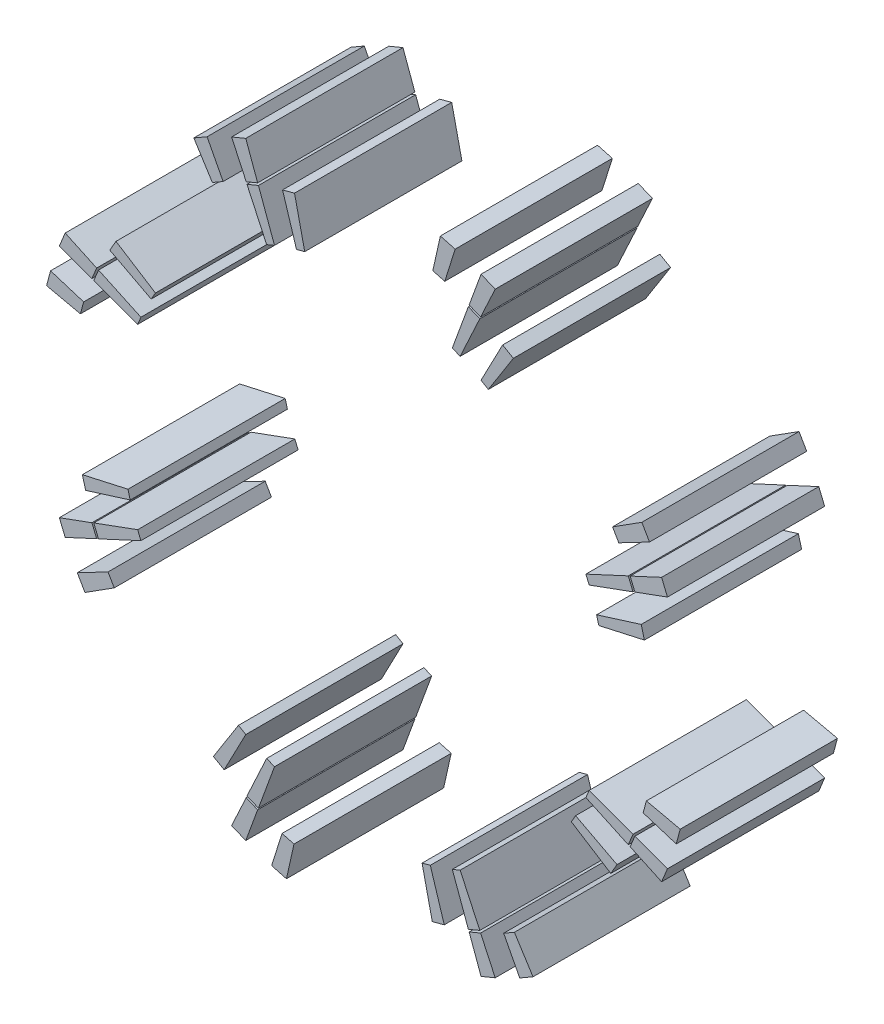
from build123d import *

# Parameters (mm, degrees)
SLOT_COPPER_ENVELOPES_START    = -15
SLOT_COPPER_ENVELOPES_DEPTH    = 30
SLOT_COPPER_ENVELOPES_2_DEPTH  = 30
SLOT_COPPER_ENVELOPES_3_DEPTH  = 30
SLOT_COPPER_ENVELOPES_4_DEPTH  = 30
SLOT_COPPER_ENVELOPES_5_DEPTH  = 30
SLOT_COPPER_ENVELOPES_6_DEPTH  = 30
SLOT_COPPER_ENVELOPES_7_DEPTH  = 30
SLOT_COPPER_ENVELOPES_8_DEPTH  = 30
SLOT_COPPER_ENVELOPES_9_DEPTH  = 30
SLOT_COPPER_ENVELOPES_10_DEPTH = 30
SLOT_COPPER_ENVELOPES_11_DEPTH = 30
SLOT_COPPER_ENVELOPES_12_DEPTH = 30
SLOT_COPPER_ENVELOPES_13_DEPTH = 30
SLOT_COPPER_ENVELOPES_14_DEPTH = 30
SLOT_COPPER_ENVELOPES_15_DEPTH = 30
SLOT_COPPER_ENVELOPES_16_DEPTH = 30
SLOT_COPPER_ENVELOPES_17_DEPTH = 30
SLOT_COPPER_ENVELOPES_18_DEPTH = 30
SLOT_COPPER_ENVELOPES_19_DEPTH = 30
SLOT_COPPER_ENVELOPES_20_DEPTH = 30
SLOT_COPPER_ENVELOPES_21_DEPTH = 30
SLOT_COPPER_ENVELOPES_22_DEPTH = 30
SLOT_COPPER_ENVELOPES_23_DEPTH = 30
SLOT_COPPER_ENVELOPES_24_DEPTH = 30
SLOT_COPPER_ENVELOPES_25_DEPTH = 30
SLOT_COPPER_ENVELOPES_26_DEPTH = 30
SLOT_COPPER_ENVELOPES_27_DEPTH = 30
SLOT_COPPER_ENVELOPES_28_DEPTH = 30
SLOT_COPPER_ENVELOPES_29_DEPTH = 30
SLOT_COPPER_ENVELOPES_30_DEPTH = 30
SLOT_COPPER_ENVELOPES_31_DEPTH = 30
SLOT_COPPER_ENVELOPES_32_DEPTH = 30


with BuildPart() as part:
    # Эскиз1 → Slot_copper_envelopes (new body)
    with BuildSketch(Plane.XY.offset(SLOT_COPPER_ENVELOPES_START)):
        Polygon((44.925769503, 11.196661761), (53.625237562, 13.144311295), (53.01297366, 15.429311284), (44.505188554, 12.766291229), align=None)
    extrude(amount=SLOT_COPPER_ENVELOPES_DEPTH)


with BuildPart() as body_2:
    # Эскиз1 → Slot_copper_envelopes 2 (new body)
    with BuildSketch(Plane.XY.offset(SLOT_COPPER_ENVELOPES_START)):
        Polygon((51.808716356, 20.179616189), (58.024981442, 22.451735677), (56.905632402, 25.154083309), (50.903438109, 22.365151211), align=None)
    extrude(amount=SLOT_COPPER_ENVELOPES_2_DEPTH)


with BuildPart() as body_3:
    # Эскиз1 → Slot_copper_envelopes 3 (new body)
    with BuildSketch(Plane.XY.offset(SLOT_COPPER_ENVELOPES_START)):
        Polygon((43.079965691, 16.964862393), (51.450789318, 20.031357956), (50.545511071, 22.216892977), (42.458105114, 18.466166634), align=None)
    extrude(amount=SLOT_COPPER_ENVELOPES_3_DEPTH)


with BuildPart() as body_4:
    # Эскиз1 → Slot_copper_envelopes 4 (new body)
    with BuildSketch(Plane.XY.offset(SLOT_COPPER_ENVELOPES_START)):
        Polygon((48.731517144, 26.769371245), (54.598030115, 29.833437847), (53.135530115, 32.366562153), (47.548714114, 28.818046189), align=None)
    extrude(amount=SLOT_COPPER_ENVELOPES_4_DEPTH)


with BuildPart() as body_5:
    # Эскиз1 → Slot_copper_envelopes 5 (new body)
    with BuildSketch(Plane.XY.offset(SLOT_COPPER_ENVELOPES_START)):
        Polygon((23.850080808, 39.684551723), (28.624337472, 47.213200774), (26.575662528, 48.396003804), (22.442789526, 40.497051723), align=None)
    extrude(amount=SLOT_COPPER_ENVELOPES_5_DEPTH)


with BuildPart() as body_6:
    # Эскиз1 → Slot_copper_envelopes 6 (new body)
    with BuildSketch(Plane.XY.offset(SLOT_COPPER_ENVELOPES_START)):
        Polygon((22.365151211, 50.903438109), (25.154083309, 56.905632402), (22.451735677, 58.024981442), (20.179616189, 51.808716356), align=None)
    extrude(amount=SLOT_COPPER_ENVELOPES_6_DEPTH)


with BuildPart() as body_7:
    # Эскиз1 → Slot_copper_envelopes 7 (new body)
    with BuildSketch(Plane.XY.offset(SLOT_COPPER_ENVELOPES_START)):
        Polygon((18.466166634, 42.458105114), (22.216892977, 50.545511071), (20.031357956, 51.450789318), (16.964862393, 43.079965691), align=None)
    extrude(amount=SLOT_COPPER_ENVELOPES_7_DEPTH)


with BuildPart() as body_8:
    # Эскиз1 → Slot_copper_envelopes 8 (new body)
    with BuildSketch(Plane.XY.offset(SLOT_COPPER_ENVELOPES_START)):
        Polygon((15.529582294, 53.387190165), (17.511211126, 59.702063542), (14.685878084, 60.459109249), (13.244582306, 53.999454067), align=None)
    extrude(amount=SLOT_COPPER_ENVELOPES_8_DEPTH)


with BuildPart() as body_9:
    # Эскиз1 → Slot_copper_envelopes 9 (new body)
    with BuildSketch(Plane.XY.offset(SLOT_COPPER_ENVELOPES_START)):
        Polygon((-11.196661761, 44.925769503), (-13.144311295, 53.625237562), (-15.429311284, 53.01297366), (-12.766291229, 44.505188554), align=None)
    extrude(amount=SLOT_COPPER_ENVELOPES_9_DEPTH)


with BuildPart() as body_10:
    # Эскиз1 → Slot_copper_envelopes 10 (new body)
    with BuildSketch(Plane.XY.offset(SLOT_COPPER_ENVELOPES_START)):
        Polygon((-20.179616189, 51.808716356), (-22.451735677, 58.024981442), (-25.154083309, 56.905632402), (-22.365151211, 50.903438109), align=None)
    extrude(amount=SLOT_COPPER_ENVELOPES_10_DEPTH)


with BuildPart() as body_11:
    # Эскиз1 → Slot_copper_envelopes 11 (new body)
    with BuildSketch(Plane.XY.offset(SLOT_COPPER_ENVELOPES_START)):
        Polygon((-16.964862393, 43.079965691), (-20.031357956, 51.450789318), (-22.216892977, 50.545511071), (-18.466166634, 42.458105114), align=None)
    extrude(amount=SLOT_COPPER_ENVELOPES_11_DEPTH)


with BuildPart() as body_12:
    # Эскиз1 → Slot_copper_envelopes 12 (new body)
    with BuildSketch(Plane.XY.offset(SLOT_COPPER_ENVELOPES_START)):
        Polygon((-26.769371245, 48.731517144), (-29.833437847, 54.598030115), (-32.366562153, 53.135530115), (-28.818046189, 47.548714114), align=None)
    extrude(amount=SLOT_COPPER_ENVELOPES_12_DEPTH)


with BuildPart() as body_13:
    # Эскиз1 → Slot_copper_envelopes 13 (new body)
    with BuildSketch(Plane.XY.offset(SLOT_COPPER_ENVELOPES_START)):
        Polygon((-39.684551723, 23.850080808), (-47.213200774, 28.624337472), (-48.396003804, 26.575662528), (-40.497051723, 22.442789526), align=None)
    extrude(amount=SLOT_COPPER_ENVELOPES_13_DEPTH)


with BuildPart() as body_14:
    # Эскиз1 → Slot_copper_envelopes 14 (new body)
    with BuildSketch(Plane.XY.offset(SLOT_COPPER_ENVELOPES_START)):
        Polygon((-50.903438109, 22.365151211), (-56.905632402, 25.154083309), (-58.024981442, 22.451735677), (-51.808716356, 20.179616189), align=None)
    extrude(amount=SLOT_COPPER_ENVELOPES_14_DEPTH)


with BuildPart() as body_15:
    # Эскиз1 → Slot_copper_envelopes 15 (new body)
    with BuildSketch(Plane.XY.offset(SLOT_COPPER_ENVELOPES_START)):
        Polygon((-42.458105114, 18.466166634), (-50.545511071, 22.216892977), (-51.450789318, 20.031357956), (-43.079965691, 16.964862393), align=None)
    extrude(amount=SLOT_COPPER_ENVELOPES_15_DEPTH)


with BuildPart() as body_16:
    # Эскиз1 → Slot_copper_envelopes 16 (new body)
    with BuildSketch(Plane.XY.offset(SLOT_COPPER_ENVELOPES_START)):
        Polygon((-53.387190165, 15.529582294), (-59.702063542, 17.511211126), (-60.459109249, 14.685878084), (-53.999454067, 13.244582306), align=None)
    extrude(amount=SLOT_COPPER_ENVELOPES_16_DEPTH)


with BuildPart() as body_17:
    # Эскиз1 → Slot_copper_envelopes 17 (new body)
    with BuildSketch(Plane.XY.offset(SLOT_COPPER_ENVELOPES_START)):
        Polygon((-44.925769503, -11.196661761), (-53.625237562, -13.144311295), (-53.01297366, -15.429311284), (-44.505188554, -12.766291229), align=None)
    extrude(amount=SLOT_COPPER_ENVELOPES_17_DEPTH)


with BuildPart() as body_18:
    # Эскиз1 → Slot_copper_envelopes 18 (new body)
    with BuildSketch(Plane.XY.offset(SLOT_COPPER_ENVELOPES_START)):
        Polygon((-51.808716356, -20.179616189), (-58.024981442, -22.451735677), (-56.905632402, -25.154083309), (-50.903438109, -22.365151211), align=None)
    extrude(amount=SLOT_COPPER_ENVELOPES_18_DEPTH)


with BuildPart() as body_19:
    # Эскиз1 → Slot_copper_envelopes 19 (new body)
    with BuildSketch(Plane.XY.offset(SLOT_COPPER_ENVELOPES_START)):
        Polygon((-43.079965691, -16.964862393), (-51.450789318, -20.031357956), (-50.545511071, -22.216892977), (-42.458105114, -18.466166634), align=None)
    extrude(amount=SLOT_COPPER_ENVELOPES_19_DEPTH)


with BuildPart() as body_20:
    # Эскиз1 → Slot_copper_envelopes 20 (new body)
    with BuildSketch(Plane.XY.offset(SLOT_COPPER_ENVELOPES_START)):
        Polygon((-48.731517144, -26.769371245), (-54.598030115, -29.833437847), (-53.135530115, -32.366562153), (-47.548714114, -28.818046189), align=None)
    extrude(amount=SLOT_COPPER_ENVELOPES_20_DEPTH)


with BuildPart() as body_21:
    # Эскиз1 → Slot_copper_envelopes 21 (new body)
    with BuildSketch(Plane.XY.offset(SLOT_COPPER_ENVELOPES_START)):
        Polygon((-23.850080808, -39.684551723), (-28.624337472, -47.213200774), (-26.575662528, -48.396003804), (-22.442789526, -40.497051723), align=None)
    extrude(amount=SLOT_COPPER_ENVELOPES_21_DEPTH)


with BuildPart() as body_22:
    # Эскиз1 → Slot_copper_envelopes 22 (new body)
    with BuildSketch(Plane.XY.offset(SLOT_COPPER_ENVELOPES_START)):
        Polygon((-22.365151211, -50.903438109), (-25.154083309, -56.905632402), (-22.451735677, -58.024981442), (-20.179616189, -51.808716356), align=None)
    extrude(amount=SLOT_COPPER_ENVELOPES_22_DEPTH)


with BuildPart() as body_23:
    # Эскиз1 → Slot_copper_envelopes 23 (new body)
    with BuildSketch(Plane.XY.offset(SLOT_COPPER_ENVELOPES_START)):
        Polygon((-18.466166634, -42.458105114), (-22.216892977, -50.545511071), (-20.031357956, -51.450789318), (-16.964862393, -43.079965691), align=None)
    extrude(amount=SLOT_COPPER_ENVELOPES_23_DEPTH)


with BuildPart() as body_24:
    # Эскиз1 → Slot_copper_envelopes 24 (new body)
    with BuildSketch(Plane.XY.offset(SLOT_COPPER_ENVELOPES_START)):
        Polygon((-15.529582294, -53.387190165), (-17.511211126, -59.702063542), (-14.685878084, -60.459109249), (-13.244582306, -53.999454067), align=None)
    extrude(amount=SLOT_COPPER_ENVELOPES_24_DEPTH)


with BuildPart() as body_25:
    # Эскиз1 → Slot_copper_envelopes 25 (new body)
    with BuildSketch(Plane.XY.offset(SLOT_COPPER_ENVELOPES_START)):
        Polygon((11.196661761, -44.925769503), (13.144311295, -53.625237562), (15.429311284, -53.01297366), (12.766291229, -44.505188554), align=None)
    extrude(amount=SLOT_COPPER_ENVELOPES_25_DEPTH)


with BuildPart() as body_26:
    # Эскиз1 → Slot_copper_envelopes 26 (new body)
    with BuildSketch(Plane.XY.offset(SLOT_COPPER_ENVELOPES_START)):
        Polygon((20.179616189, -51.808716356), (22.451735677, -58.024981442), (25.154083309, -56.905632402), (22.365151211, -50.903438109), align=None)
    extrude(amount=SLOT_COPPER_ENVELOPES_26_DEPTH)


with BuildPart() as body_27:
    # Эскиз1 → Slot_copper_envelopes 27 (new body)
    with BuildSketch(Plane.XY.offset(SLOT_COPPER_ENVELOPES_START)):
        Polygon((16.964862393, -43.079965691), (20.031357956, -51.450789318), (22.216892977, -50.545511071), (18.466166634, -42.458105114), align=None)
    extrude(amount=SLOT_COPPER_ENVELOPES_27_DEPTH)


with BuildPart() as body_28:
    # Эскиз1 → Slot_copper_envelopes 28 (new body)
    with BuildSketch(Plane.XY.offset(SLOT_COPPER_ENVELOPES_START)):
        Polygon((26.769371245, -48.731517144), (29.833437847, -54.598030115), (32.366562153, -53.135530115), (28.818046189, -47.548714114), align=None)
    extrude(amount=SLOT_COPPER_ENVELOPES_28_DEPTH)


with BuildPart() as body_29:
    # Эскиз1 → Slot_copper_envelopes 29 (new body)
    with BuildSketch(Plane.XY.offset(SLOT_COPPER_ENVELOPES_START)):
        Polygon((39.684551723, -23.850080808), (47.213200774, -28.624337472), (48.396003804, -26.575662528), (40.497051723, -22.442789526), align=None)
    extrude(amount=SLOT_COPPER_ENVELOPES_29_DEPTH)


with BuildPart() as body_30:
    # Эскиз1 → Slot_copper_envelopes 30 (new body)
    with BuildSketch(Plane.XY.offset(SLOT_COPPER_ENVELOPES_START)):
        Polygon((50.903438109, -22.365151211), (56.905632402, -25.154083309), (58.024981442, -22.451735677), (51.808716356, -20.179616189), align=None)
    extrude(amount=SLOT_COPPER_ENVELOPES_30_DEPTH)


with BuildPart() as body_31:
    # Эскиз1 → Slot_copper_envelopes 31 (new body)
    with BuildSketch(Plane.XY.offset(SLOT_COPPER_ENVELOPES_START)):
        Polygon((42.458105114, -18.466166634), (50.545511071, -22.216892977), (51.450789318, -20.031357956), (43.079965691, -16.964862393), align=None)
    extrude(amount=SLOT_COPPER_ENVELOPES_31_DEPTH)


with BuildPart() as body_32:
    # Эскиз1 → Slot_copper_envelopes 32 (new body)
    with BuildSketch(Plane.XY.offset(SLOT_COPPER_ENVELOPES_START)):
        Polygon((53.387190165, -15.529582294), (59.702063542, -17.511211126), (60.459109249, -14.685878084), (53.999454067, -13.244582306), align=None)
    extrude(amount=SLOT_COPPER_ENVELOPES_32_DEPTH)


solid = Compound([part.part, body_2.part, body_3.part, body_4.part, body_5.part, body_6.part, body_7.part, body_8.part, body_9.part, body_10.part, body_11.part, body_12.part, body_13.part, body_14.part, body_15.part, body_16.part, body_17.part, body_18.part, body_19.part, body_20.part, body_21.part, body_22.part, body_23.part, body_24.part, body_25.part, body_26.part, body_27.part, body_28.part, body_29.part, body_30.part, body_31.part, body_32.part])
